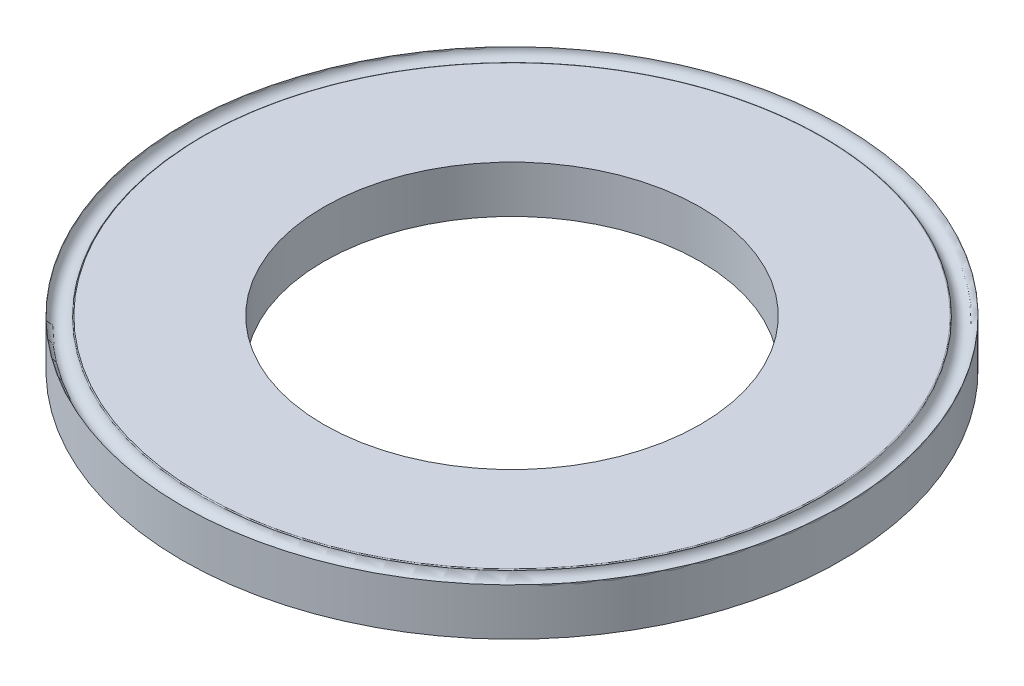
from build123d import *

# Parameters (mm, degrees)
DIAPROFILES_R    = 3.5
DIAPROFILES_R_2  = 2
DIAPROFILE_DEPTH = 0.25


with BuildPart() as part:
    # DiaProfileS → DiaProfile (new, symmetric)
    with BuildSketch(Plane(origin=(0, 0, 0), x_dir=(1, 0, 0), z_dir=(0, 1, 0))):
        with Locations(Location((0, 0, 0), (0, 0, 270))):
            Circle(DIAPROFILES_R)
        with Locations(Location((0, 0, 0), (0, 0, 270))):
            Circle(DIAPROFILES_R_2, mode=Mode.SUBTRACT)
    extrude(amount=DIAPROFILE_DEPTH, both=True)

    # CrimpS → Crimp (revolve, cut)
    with BuildSketch(Plane.XY, mode=Mode.PRIVATE) as crimp_sk:
        with BuildLine():
            Line((-3.5, 0.25), (-3.290455488, 0.25))
            ThreePointArc((-3.290455488, 0.25), (-3.297197487, 0.247385489), (-3.30041408, 0.240909091))
            ThreePointArc((-3.30041408, 0.240909091), (-3.404550167, 0.150103574), (-3.5, 0.25))
        make_face()
    revolve(crimp_sk.sketch.rotate(Axis((0, 0.25, 0), (0, -1, 0)), 270), axis=Axis((0, 0.25, 0), (0, -1, 0)), mode=Mode.SUBTRACT)


solid = part.part
